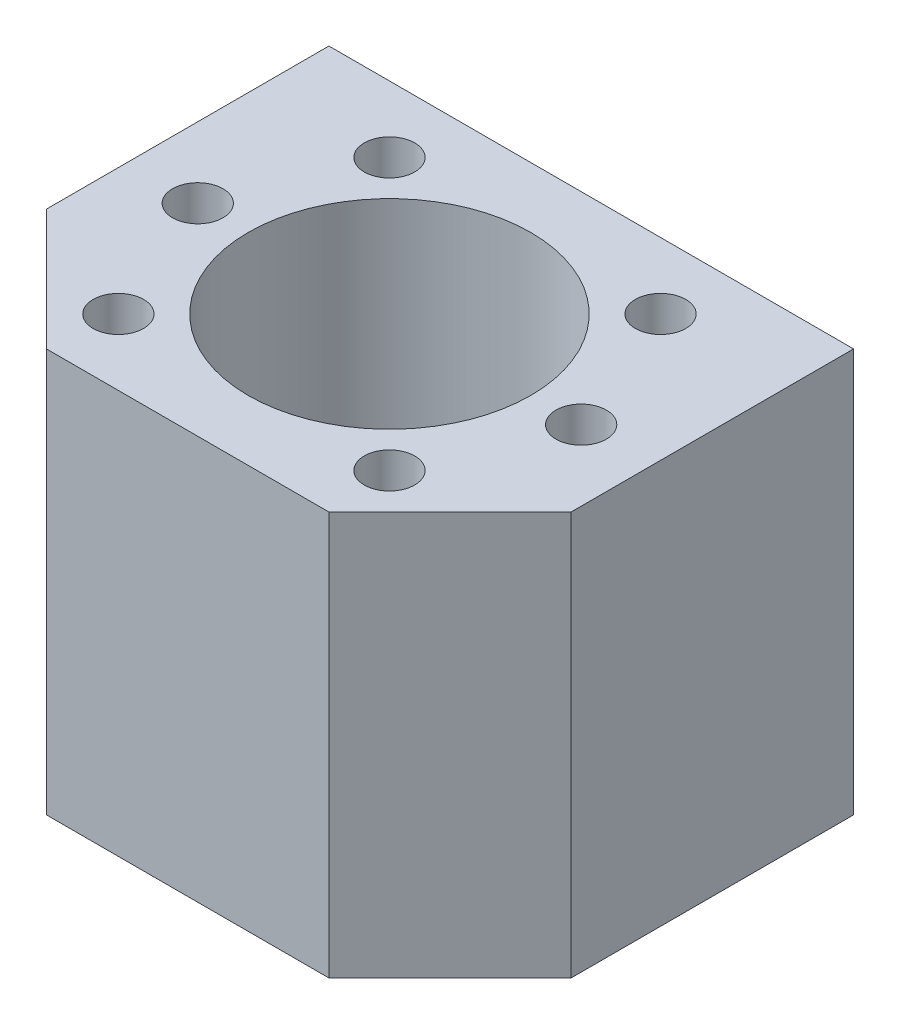
from build123d import *

# Parameters (mm, degrees)
SKETCH_1_R          = 14
SKETCH_1_R_2        = 2.5
EXTRUDE_1_DEPTH     = 40
SKETCH_2_R          = 2.5
CUT_EXTRUDE_1_DEPTH = 10


with BuildPart() as part:
    # 草图1 → 凸台-拉伸1 (new body)
    with BuildSketch(Plane(origin=(0, 0, 0), x_dir=(1, 0, 0), z_dir=(0, 1, 0))):
        Polygon((-26, -8), (-14, -20), (14, -20), (26, -8), (26, 20), (-26, 20), align=None)
        with Locations(Location((0, 0, 0), (0, 0, 270))):
            Circle(SKETCH_1_R, mode=Mode.SUBTRACT)
        with Locations(Location((13.435028843, 13.435028843, 0), (0, 0, 270))):
            Circle(SKETCH_1_R_2, mode=Mode.SUBTRACT)
        with Locations(Location((19, 0, 0), (0, 0, 270))):
            Circle(SKETCH_1_R_2, mode=Mode.SUBTRACT)
        with Locations(Location((13.435028843, -13.435028843, 0), (0, 0, 270))):
            Circle(SKETCH_1_R_2, mode=Mode.SUBTRACT)
        with Locations(Location((-13.435028843, -13.435028843, 0), (0, 0, 270))):
            Circle(SKETCH_1_R_2, mode=Mode.SUBTRACT)
        with Locations(Location((-19, 0, 0), (0, 0, 270))):
            Circle(SKETCH_1_R_2, mode=Mode.SUBTRACT)
        with Locations(Location((-13.435028843, 13.435028843, 0), (0, 0, 270))):
            Circle(SKETCH_1_R_2, mode=Mode.SUBTRACT)
    extrude(amount=EXTRUDE_1_DEPTH)

    # 草图2 → 切除-拉伸1 (cut)
    with BuildSketch(Plane(origin=(0, 0, -20), x_dir=(-1, 0, 0), z_dir=(0, 0, -1))):
        with Locations((-20, 32)):
            Circle(SKETCH_2_R)
        with Locations((-20, 8)):
            Circle(SKETCH_2_R)
        with Locations((20, 32)):
            Circle(SKETCH_2_R)
        with Locations((20, 8)):
            Circle(SKETCH_2_R)
    extrude(amount=-CUT_EXTRUDE_1_DEPTH, mode=Mode.SUBTRACT)


solid = part.part
